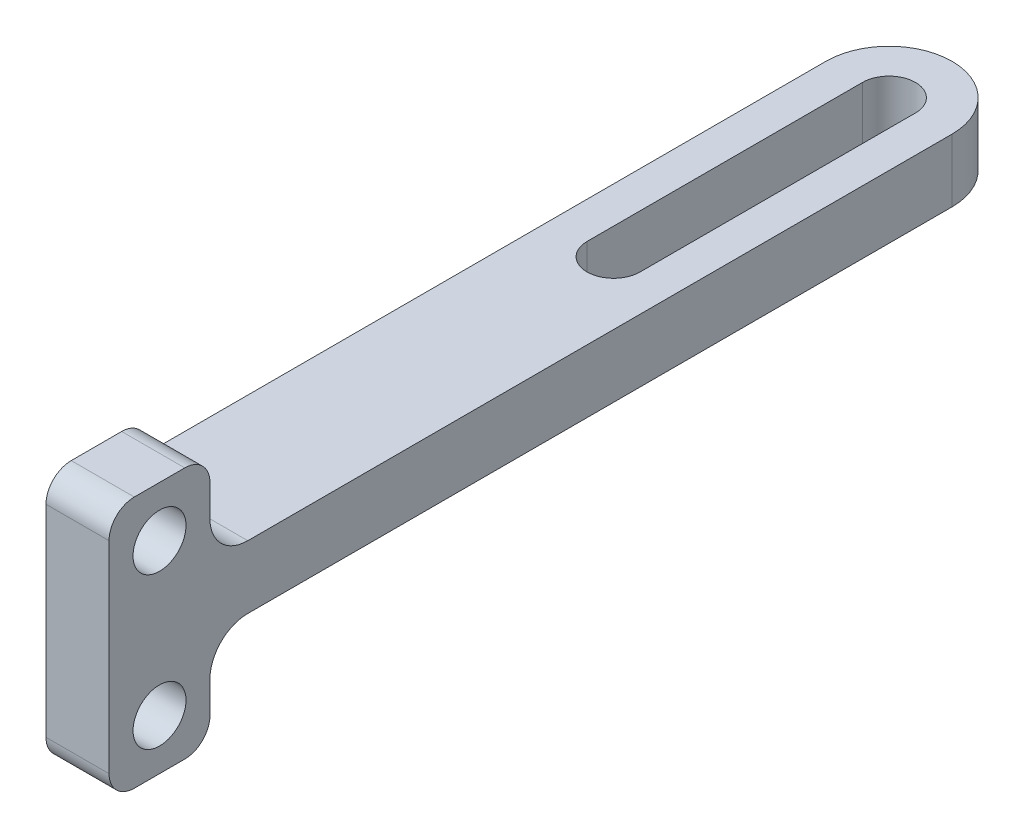
from build123d import *

# Parameters (mm, degrees)
BOSS_EXTRUDE1_DEPTH = 5
SKETCH2_W           = 5
SKETCH2_H           = 20
BOSS_EXTRUDE2_DEPTH = 8
SKETCH3_R           = 2.1
CUT_EXTRUDE1_DEPTH  = 8
FILLET2_R           = 2
SKETCH4_W           = 5
SKETCH4_H           = 5
CUT_EXTRUDE2_DEPTH  = 3
FILLET3_R           = 3


with BuildPart() as part:
    # Sketch1 → Boss-Extrude1 (new body)
    with BuildSketch(Plane(origin=(0, 0, 0), x_dir=(1, 0, 0), z_dir=(0, 1, 0))):
        with BuildLine():
            Line((-5, 0), (-5, 13.835803565))
            ThreePointArc((-5, 13.835803565), (0, 18.835803565), (5, 13.835803565))
            Line((5, 13.835803565), (5, 0))
            Line((5, 0), (5, -45))
            Line((5, -45), (-5, -45))
            Line((-5, -45), (-5, 0))
        make_face()
        with BuildLine():
            Line((-2.1, -8), (-2.1, 13.835803565))
            ThreePointArc((-2.1, 13.835803565), (0, 15.935803565), (2.1, 13.835803565))
            Line((2.1, 13.835803565), (2.1, -8))
            ThreePointArc((2.1, -8), (0, -10.1), (-2.1, -8))
        make_face(mode=Mode.SUBTRACT)
    extrude(amount=BOSS_EXTRUDE1_DEPTH)

    # Sketch2 → Boss-Extrude2 (add)
    with BuildSketch(Plane.XY.offset(45)):
        with Locations((2.5, 2.5)):
            Rectangle(SKETCH2_W, SKETCH2_H)
    extrude(amount=BOSS_EXTRUDE2_DEPTH)

    # Sketch3 → Cut-Extrude1 (cut)
    with BuildSketch(Plane(origin=(5, 0, 0), x_dir=(0, 0, -1), z_dir=(1, 0, 0))):
        with Locations((-49, 8.5)):
            Circle(SKETCH3_R)
        with Locations((-49, -3.5)):
            Circle(SKETCH3_R)
    extrude(amount=-CUT_EXTRUDE1_DEPTH, mode=Mode.SUBTRACT)

    # Fillet2
    fillet2_edges = [part.edges().sort_by_distance(p)[0] for p in [
        (2.5, 12.5, 45),
        (2.5, -7.5, 45),
        (2.5, 12.5, 53),
        (2.5, -7.5, 53),
    ]]
    fillet(fillet2_edges, radius=FILLET2_R)

    # Sketch4 → Cut-Extrude2 (cut)
    with BuildSketch(Plane.XY.offset(45)):
        with Locations((-2.5, 2.5)):
            Rectangle(SKETCH4_W, SKETCH4_H)
    extrude(amount=-CUT_EXTRUDE2_DEPTH, mode=Mode.SUBTRACT)

    # Fillet3
    fillet3_edges = [part.edges().sort_by_distance(p)[0] for p in [
        (2.5, 0, 45),
        (2.5, 5, 45),
        (-5, 2.5, 42),
    ]]
    fillet(fillet3_edges, radius=FILLET3_R)


solid = part.part
